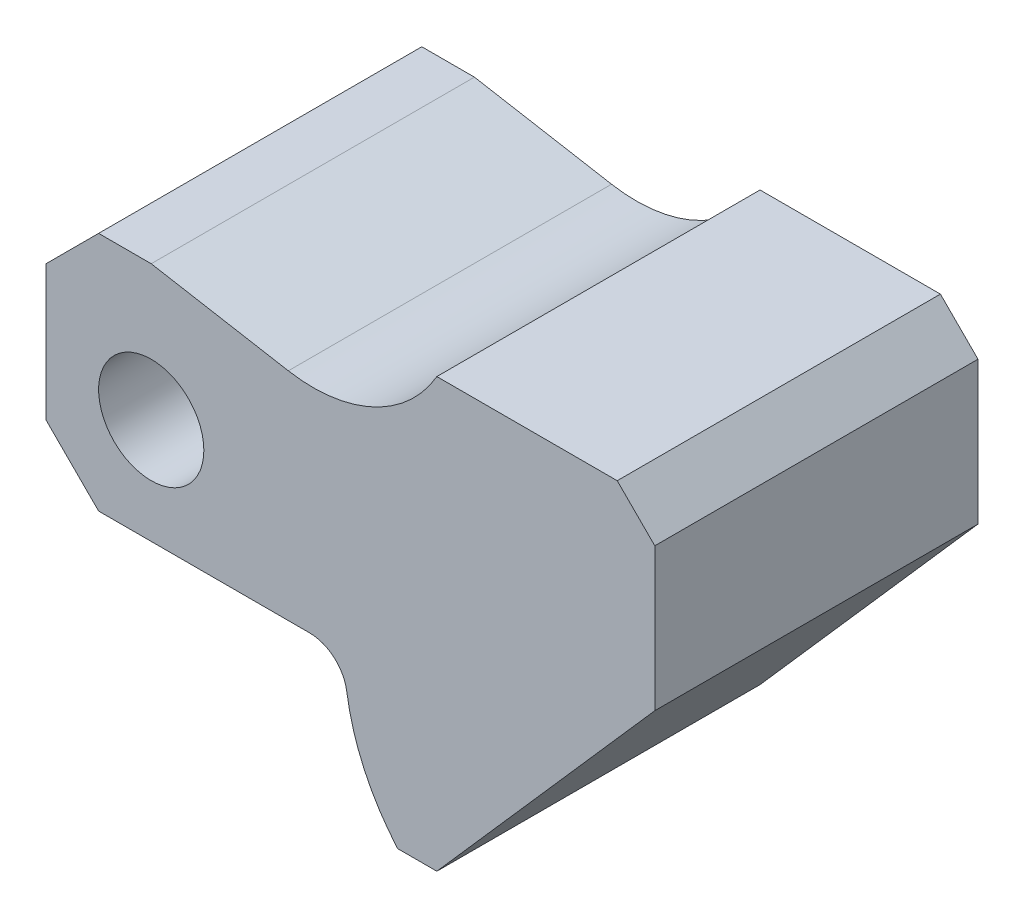
from build123d import *

# Parameters (mm, degrees)
ESQUISSE1_R        = 7
BOSS_EXTRU_2_DEPTH = 43


with BuildPart() as part:
    # Esquisse1 → Boss.-Extru.2 (new body)
    with BuildSketch(Plane.XY):
        with BuildLine():
            Line((35.010307264, -5.230818644), (59.010307264, -5.230818644))
            Line((59.010307264, -5.230818644), (64.010307264, -10.230818644))
            Line((64.010307264, -10.230818644), (64.010307264, -29.230818644))
            Line((64.010307264, -29.230818644), (35.010307264, -62.230818644))
            Line((35.010307264, -62.230818644), (29.798374661, -62.230818644))
            ThreePointArc((29.798374661, -62.230818644), (25.359402464, -55.346490705), (23.022572261, -47.495524527))
            ThreePointArc((23.022572261, -47.495524527), (21.342169301, -44.444232412), (18.076933519, -43.230818644))
            Line((18.076933519, -43.230818644), (-9.989692736, -43.230818644))
            Line((-9.989692736, -43.230818644), (-16.989692736, -36.230818644))
            Line((-16.989692736, -36.230818644), (-16.989692736, -18.230818644))
            Line((-16.989692736, -18.230818644), (-9.989692736, -11.230818644))
            Line((-9.989692736, -11.230818644), (-2.989692736, -11.230818644))
            Line((-2.989692736, -11.230818644), (15.253392252, -14.447566739))
            ThreePointArc((15.253392252, -14.447566739), (26.585280225, -12.954749493), (35.010307264, -5.230818644))
        make_face()
        with Locations((-2.989692736, -29.230818644)):
            Circle(ESQUISSE1_R, mode=Mode.SUBTRACT)
    extrude(amount=BOSS_EXTRU_2_DEPTH)


solid = part.part
